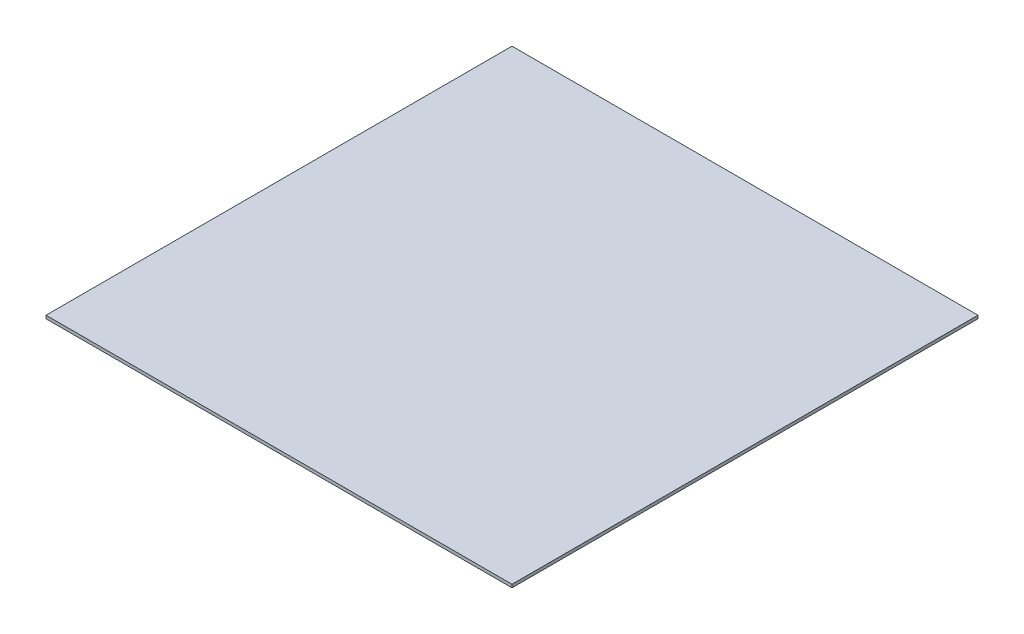
from build123d import *

# Parameters (mm, degrees)
SKETCH1_W           = 300
SKETCH1_H           = 300
BOSS_EXTRUDE1_DEPTH = 2


with BuildPart() as part:
    # Sketch1 → Boss-Extrude1 (new body)
    with BuildSketch(Plane(origin=(0, 0, 0), x_dir=(1, 0, 0), z_dir=(0, 1, 0))):
        with Locations((150, 150)):
            Rectangle(SKETCH1_W, SKETCH1_H)
    extrude(amount=BOSS_EXTRUDE1_DEPTH)


solid = part.part
